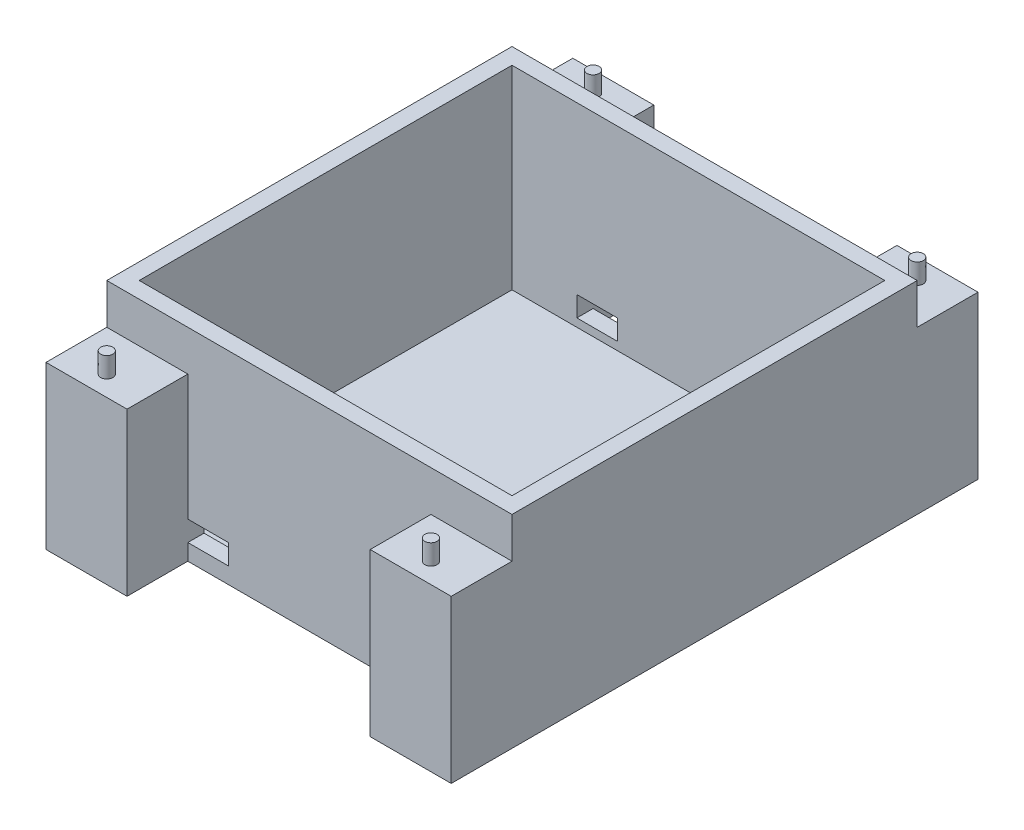
from build123d import *

# Parameters (mm, degrees)
SKETCH1_W               = 100
SKETCH1_H               = 100
BOSS_EXTRUDE1_DEPTH     = 50
SKETCH2_W               = 92
SKETCH2_H               = 92
CUT_EXTRUDE1_DEPTH      = 48
CUT_EXTRUDE2_DEPTH      = 123.474487139
CUT_EXTRUDE2_DEPTH_BACK = 123.474487139
SKETCH6_W               = 10
SKETCH6_H               = 5
SKETCH3_W               = 20
SKETCH3_H               = 40
BOSS_EXTRUDE2_DEPTH     = 15
BOSS_EXTRUDE3_START     = -43
SKETCH5_R               = 1.5
BOSS_EXTRUDE3_DEPTH     = 48
MIRROR2_COPY_1_SKETCH_W = 20
MIRROR2_COPY_1_SKETCH_H = 40
MIRROR2_COPY_1_DEPTH    = 15
MIRROR2_START           = -43
MIRROR2_COPY_2_SKETCH_R = 1.5
MIRROR2_COPY_2_DEPTH    = 48


with BuildPart() as part:
    # Sketch1 → Boss-Extrude1 (new body)
    with BuildSketch(Plane(origin=(0, 0, 0), x_dir=(1, 0, 0), z_dir=(0, 1, 0))):
        Rectangle(SKETCH1_W, SKETCH1_H)
    extrude(amount=BOSS_EXTRUDE1_DEPTH)

    # Sketch2 → Cut-Extrude1 (cut)
    with BuildSketch(Plane(origin=(0, 50, 0), x_dir=(1, 0, 0), z_dir=(0, 1, 0))):
        Rectangle(SKETCH2_W, SKETCH2_H)
    extrude(amount=-CUT_EXTRUDE1_DEPTH, mode=Mode.SUBTRACT)

    # Sketch6 → Cut-Extrude2 (cut, two sides: drawn at the far end of the back side and taken through both)
    with BuildSketch(Plane.XY.offset(50).offset(-CUT_EXTRUDE2_DEPTH_BACK)):
        with Locations((-25, 6.5)):
            Rectangle(SKETCH6_W, SKETCH6_H)
        with Locations((25, 6.5)):
            Rectangle(SKETCH6_W, SKETCH6_H)
    extrude(amount=CUT_EXTRUDE2_DEPTH + CUT_EXTRUDE2_DEPTH_BACK, mode=Mode.SUBTRACT)

    # Sketch3 → Boss-Extrude2 (add)
    with BuildSketch(Plane.XY.offset(50)):
        with Locations((-40, 20)):
            Rectangle(SKETCH3_W, SKETCH3_H)
    boss_extrude2 = extrude(amount=BOSS_EXTRUDE2_DEPTH)

    # Sketch5 → Boss-Extrude3 (add)
    with BuildSketch(Plane(origin=(0, 40, 0), x_dir=(1, 0, 0), z_dir=(0, 1, 0)).offset(BOSS_EXTRUDE3_START)):
        with Locations(Location((-40, -60, 0), (0, 0, 270))):
            Circle(SKETCH5_R)
    boss_extrude3 = extrude(amount=BOSS_EXTRUDE3_DEPTH)

    # Mirror1: Boss-Extrude2, Boss-Extrude3 across plane
    add(boss_extrude2.mirror(Plane.ZY))
    add(boss_extrude3.mirror(Plane.ZY))

    # Mirror2: Boss-Extrude2, Boss-Extrude3 across plane
    add(boss_extrude2.mirror(Plane(origin=(0, 0, 0), x_dir=(1, 0, 0), z_dir=(0, 0, -1))))
    add(boss_extrude3.mirror(Plane(origin=(0, 0, 0), x_dir=(1, 0, 0), z_dir=(0, 0, -1))))

    # Mirror2 copy 1 sketch → Mirror2 copy 1 (add)
    with BuildSketch(Plane(origin=(0, 0, -50), x_dir=(-1, 0, 0), z_dir=(0, 0, -1))):
        with Locations((-40, 20)):
            Rectangle(MIRROR2_COPY_1_SKETCH_W, MIRROR2_COPY_1_SKETCH_H)
    extrude(amount=MIRROR2_COPY_1_DEPTH)

    # Mirror2 copy 2 sketch → Mirror2 copy 2 (add)
    with BuildSketch(Plane(origin=(0, 40, 0), x_dir=(-1, 0, 0), z_dir=(0, 1, 0)).offset(MIRROR2_START)):
        with Locations(Location((-40, -60, 0), (0, 0, 270))):
            Circle(MIRROR2_COPY_2_SKETCH_R)
    extrude(amount=MIRROR2_COPY_2_DEPTH)


solid = part.part
